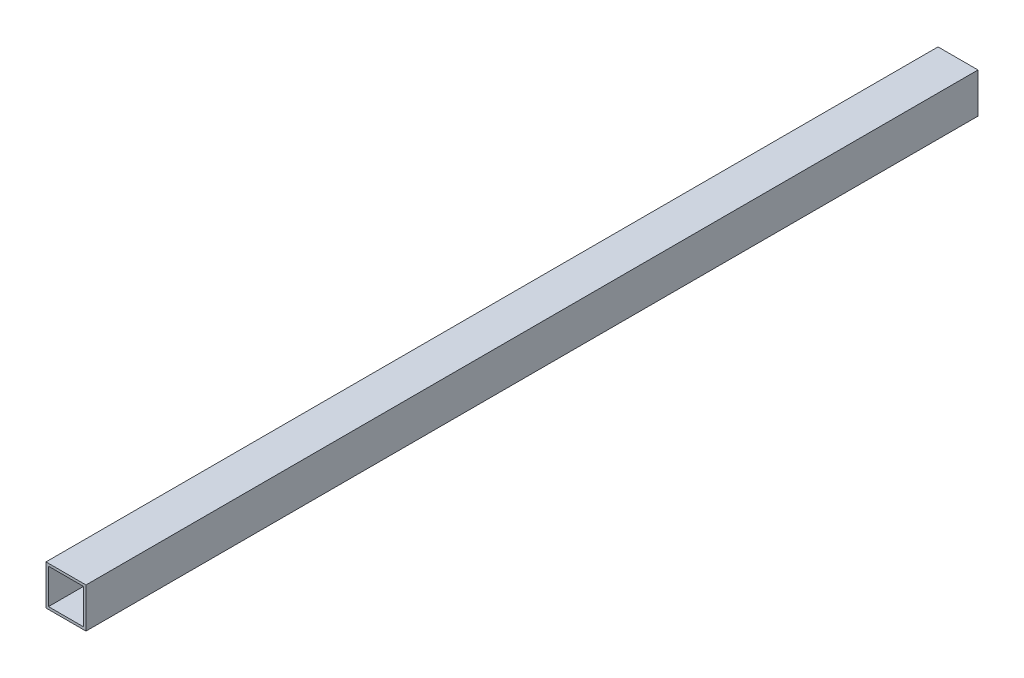
from build123d import *

# Parameters (mm, degrees)
CROQUIS2_W              = 76.2
CROQUIS2_H              = 76.2
CROQUIS2_W_2            = 66.675
CROQUIS2_H_2            = 66.675
SALIENTE_EXTRUIR1_DEPTH = 1700


with BuildPart() as part:
    # Croquis2 → Saliente-Extruir1 (new body)
    with BuildSketch(Plane.XY):
        with Locations((38.1, -38.1)):
            Rectangle(CROQUIS2_W, CROQUIS2_H)
        with Locations((38.1, -38.1)):
            Rectangle(CROQUIS2_W_2, CROQUIS2_H_2, mode=Mode.SUBTRACT)
    extrude(amount=-SALIENTE_EXTRUIR1_DEPTH)


solid = part.part
